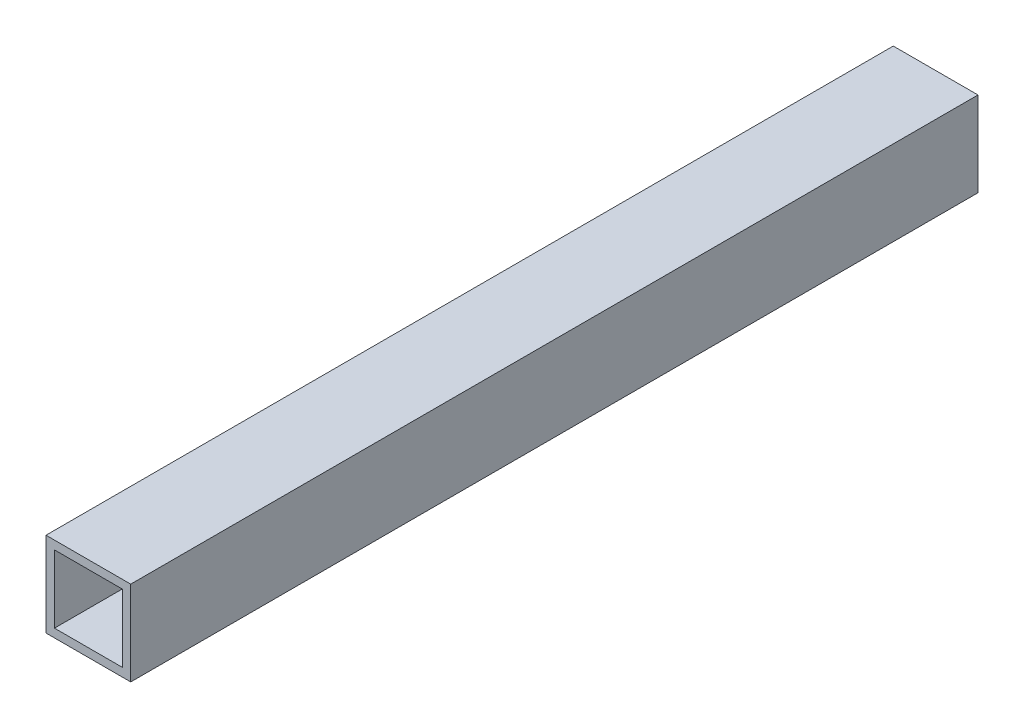
from build123d import *

# Parameters (mm, degrees)
SKETCH1_W           = 50
SKETCH1_H           = 50
SKETCH1_W_2         = 40
SKETCH1_H_2         = 40
BOSS_EXTRUDE1_DEPTH = 500


with BuildPart() as part:
    # Sketch1 → Boss-Extrude1 (new body)
    with BuildSketch(Plane.XY):
        Rectangle(SKETCH1_W, SKETCH1_H)
        Rectangle(SKETCH1_W_2, SKETCH1_H_2, mode=Mode.SUBTRACT)
    extrude(amount=BOSS_EXTRUDE1_DEPTH)


solid = part.part
